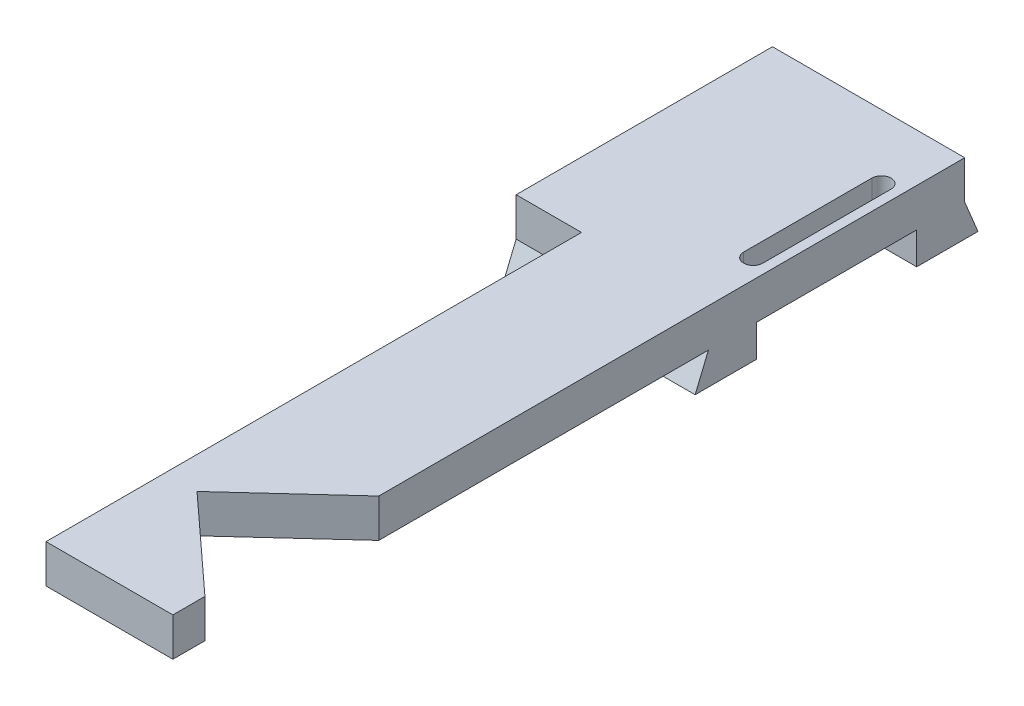
from build123d import *

# Parameters (mm, degrees)
BOSS_EXTRUDE1_DEPTH        = 6
DOVE_BOSS_DEPTH            = 30
BOSS_EXTRUDE7_DEPTH        = 30
PIN_SLOT_REACH             = 39.724
PIN_SLOT_DIRECTION_2_DEPTH = 38.723710458
BOSS_EXTRUDE8_DEPTH        = 6


with BuildPart() as part:
    # Sketch1 → Boss-Extrude1 (new body)
    with BuildSketch(Plane(origin=(0, 0, 0), x_dir=(1, 0, 0), z_dir=(0, 1, 0))):
        Polygon((-30, 20), (-30, -20), (0, -20), (0, -8.167550091), (-6.853388269, 0), (0, 8.167550091), (0, 20), align=None)
        Polygon((-6.853388269, 0), (0, -8.167550091), (0, 8.167550091), align=None)
    extrude(amount=BOSS_EXTRUDE1_DEPTH)

    # Sketch7 → Dove Boss (add)
    with BuildSketch(Plane(origin=(-30, 0, 0), x_dir=(0, 0, -1), z_dir=(1, 0, 0))):
        Polygon((-12.5, 0), (-20, 0), (-22.069851171, -5), (-12.5, -5), align=None)
    extrude(amount=DOVE_BOSS_DEPTH)

    # Sketch7<3> → Boss-Extrude7 (add)
    with BuildSketch(Plane(origin=(-30, 0, 0), x_dir=(0, 0, -1), z_dir=(1, 0, 0))):
        Polygon((20, 0), (12.5, 0), (12.5, -5), (22.069851171, -5), align=None)
    extrude(amount=BOSS_EXTRUDE7_DEPTH)

    # Sketch4 → Pin Slot (cut, up to next)
    with BuildSketch(Plane(origin=(0, 0, 0), x_dir=(1, 0, 0), z_dir=(0, 1, 0)), mode=Mode.PRIVATE) as pin_slot_sk1:
        with BuildLine():
            Line((-1.5, 10), (-1.5, -10))
            ThreePointArc((-1.5, -10), (-3, -11.5), (-4.5, -10))
            Line((-4.5, -10), (-4.5, 10))
            ThreePointArc((-4.5, 10), (-3, 11.5), (-1.5, 10))
        make_face()
    pin_slot_tool1 = extrude(pin_slot_sk1.sketch, amount=PIN_SLOT_REACH, mode=Mode.PRIVATE) & part.part
    add(pin_slot_tool1.solids().sort_by_distance((-3, 0, 0))[0], mode=Mode.SUBTRACT)

    # Sketch4 → Pin Slot direction 2 (cut)
    with BuildSketch(Plane(origin=(0, 0, 0), x_dir=(1, 0, 0), z_dir=(0, 1, 0))):
        with BuildLine():
            Line((-1.5, 10), (-1.5, -10))
            ThreePointArc((-1.5, -10), (-3, -11.5), (-4.5, -10))
            Line((-4.5, -10), (-4.5, 10))
            ThreePointArc((-4.5, 10), (-3, 11.5), (-1.5, 10))
        make_face()
    extrude(amount=-PIN_SLOT_DIRECTION_2_DEPTH, mode=Mode.SUBTRACT)

    # Sketch8 → Boss-Extrude8 (add)
    with BuildSketch(Plane(origin=(0, 6, 0), x_dir=(1, 0, 0), z_dir=(0, 1, 0))):
        Polygon((0, -103.563417049), (0, -98.563417049), (-14.801872329, -85), (0, -71.436582951), (0, -20), (-19.801872329, -20), (-19.801872329, -103.563417049), align=None)
    extrude(amount=-BOSS_EXTRUDE8_DEPTH)


solid = part.part
